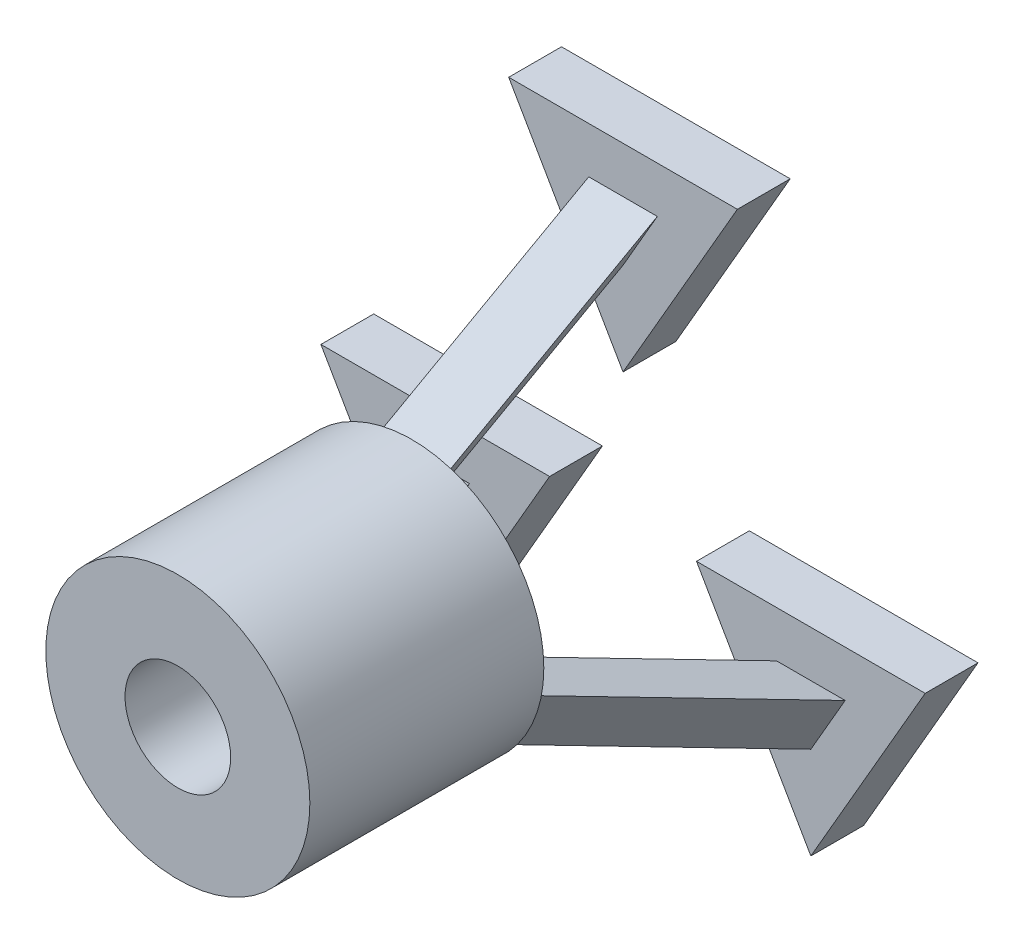
from build123d import *

# Parameters (mm, degrees)
SKETCH_1_R               = 5
SKETCH_1_R_2             = 2
EXTRUDE_1_DEPTH          = 8.86
PATTERN_CIRCULAR_1_COUNT = 3
EXTRUDE_2_DEPTH          = 2
PATTERN_CIRCULAR_2_COUNT = 3
SKETCH_5_R               = 2
EXTRUDE_3_DEPTH          = 2


with BuildPart() as part:
    # 草图1 → 凸台-拉伸1 (new body)
    with BuildSketch(Plane.XY):
        Circle(SKETCH_1_R)
        Circle(SKETCH_1_R_2, mode=Mode.SUBTRACT)
    extrude(amount=EXTRUDE_1_DEPTH)

    # 草图3 → 放样1 section 0
    with BuildSketch(Plane(origin=(0, 0, 0), x_dir=(-1, 0, 0), z_dir=(0, 0, -1))):
        with BuildLine():
            Line((0, 2.25277675), (1.299038106, 4.50277675))
            Line((1.299038106, 4.50277675), (-1.299038106, 4.50277675))
            Line((-1.299038106, 4.50277675), (0, 2.25277675))
        make_face()
    # 草图2 → 放样1 section 1
    with BuildSketch(Plane.XY.offset(-8)):
        with BuildLine():
            Line((0, 6.712322525), (1.299038106, 8.962322525))
            Line((1.299038106, 8.962322525), (-1.299038106, 8.962322525))
            Line((-1.299038106, 8.962322525), (0, 6.712322525))
        make_face()
    loft_1 = loft()

    # 阵列(圆周)1: 放样1 ×3 about axis
    pattern_circular_1_axis = Axis((0, 0, 0), (0, 0, 1))
    for i in range(1, PATTERN_CIRCULAR_1_COUNT):
        add(loft_1.rotate(pattern_circular_1_axis, i * 360 / PATTERN_CIRCULAR_1_COUNT))

    # 草图4 → 凸台-拉伸2 (add)
    with BuildSketch(Plane(origin=(0, 0, -8), x_dir=(-1, 0, 0), z_dir=(0, 0, -1))):
        Polygon((0, 3.212322525), (4.330127019, 10.712322525), (-4.330127019, 10.712322525), align=None)
    extrude_2 = extrude(amount=EXTRUDE_2_DEPTH)

    # 阵列(圆周)2: 凸台-拉伸2 ×3 about axis
    pattern_circular_2_axis = Axis((0, 0, 0), (0, 0, 1))
    for i in range(1, PATTERN_CIRCULAR_2_COUNT):
        add(extrude_2.rotate(pattern_circular_2_axis, i * 360 / PATTERN_CIRCULAR_2_COUNT))


with BuildPart() as body_2:
    # 草图5 → 凸台-拉伸3 (new body)
    with BuildSketch(Plane(origin=(0, 0, 0), x_dir=(-1, 0, 0), z_dir=(0, 0, -1))):
        Circle(SKETCH_5_R)
    extrude(amount=-EXTRUDE_3_DEPTH)


solid = Compound([part.part, body_2.part])
